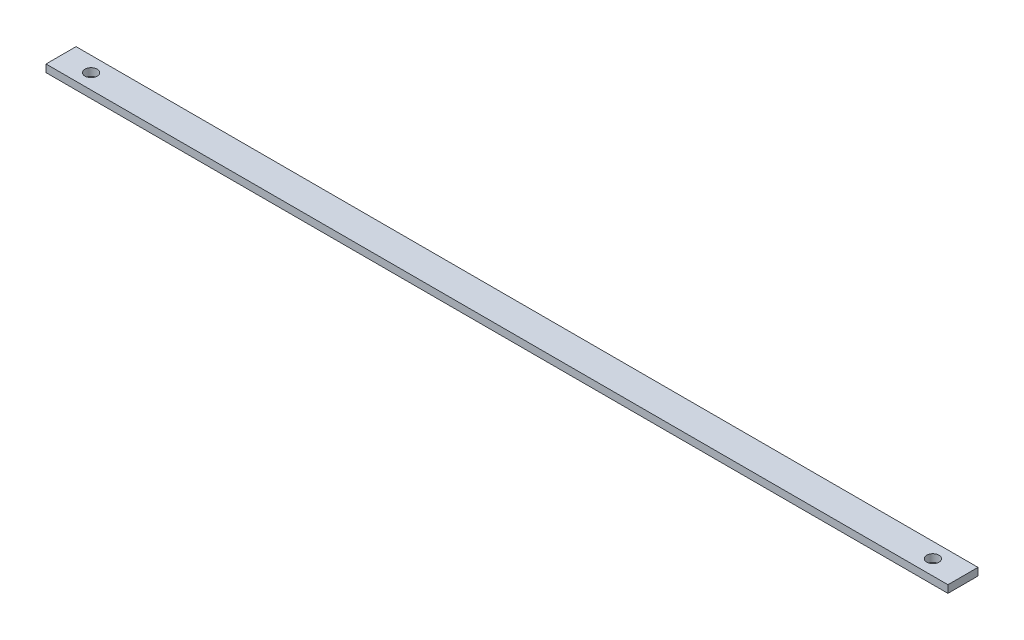
from build123d import *

# Parameters (mm, degrees)
SKETCH2_W           = 762
SKETCH2_H           = 25.4
BOSS_EXTRUDE3_DEPTH = 6.35
SKETCH5_R           = 5.159375
CUT_EXTRUDE1_DEPTH  = 382.264491528


with BuildPart() as part:
    # Sketch2 → Boss-Extrude3 (new body)
    with BuildSketch(Plane(origin=(0, 0, 0), x_dir=(1, 0, 0), z_dir=(0, 1, 0))):
        Rectangle(SKETCH2_W, SKETCH2_H)
    extrude(amount=BOSS_EXTRUDE3_DEPTH)

    # Sketch5 → Cut-Extrude1 (cut, through all)
    with BuildSketch(Plane(origin=(0, 6.35, 0), x_dir=(1, 0, 0), z_dir=(0, 1, 0))):
        with Locations(Location((355.6, 0, 0), (0, 0, 270))):
            Circle(SKETCH5_R)
        with Locations(Location((-355.6, 0, 0), (0, 0, 90))):
            Circle(SKETCH5_R)
    extrude(amount=-CUT_EXTRUDE1_DEPTH, mode=Mode.SUBTRACT)


solid = part.part
